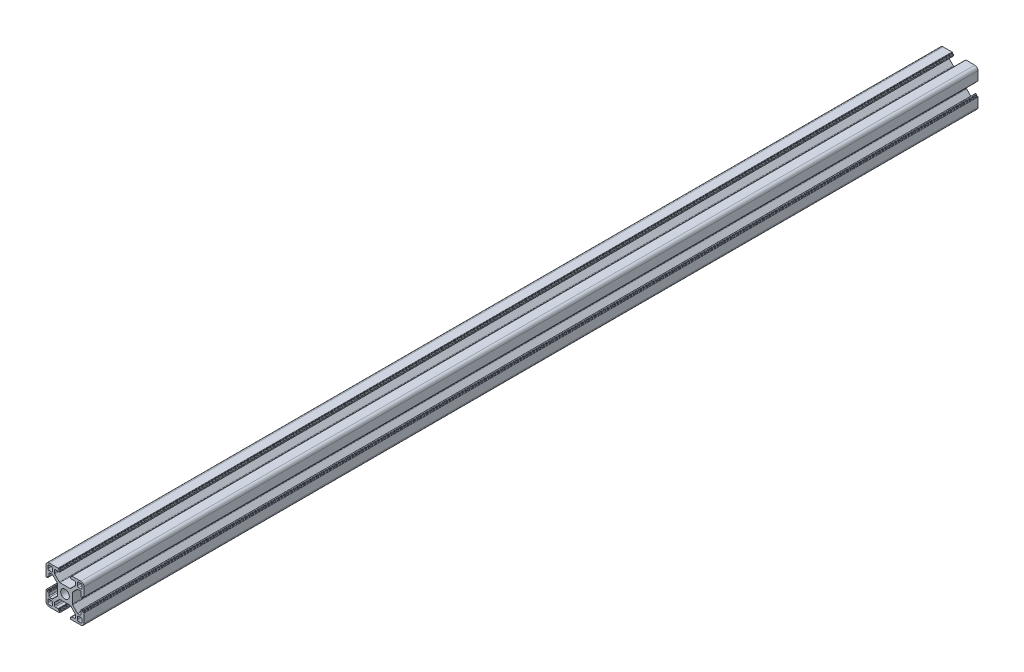
from build123d import *

# Parameters (mm, degrees)
SKETCH1_R           = 3.4
BOSS_EXTRUDE1_DEPTH = 706


with BuildPart() as part:
    # Sketch1 → Boss-Extrude1 (new body)
    with BuildSketch(Plane.XY):
        with BuildLine():
            Line((0, 2.5), (0, 10.6))
            ThreePointArc((0, 10.6), (0.058578644, 10.741421356), (0.2, 10.8))
            Line((0.2, 10.8), (1, 10.8))
            ThreePointArc((1, 10.8), (1.141421356, 10.741421356), (1.2, 10.6))
            Line((1.2, 10.6), (1.2, 9.9))
            ThreePointArc((1.2, 9.9), (1.258578644, 9.758578644), (1.4, 9.7))
            Line((1.4, 9.7), (2, 9.7))
            ThreePointArc((2, 9.7), (2.141421356, 9.641421356), (2.2, 9.5))
            Line((2.2, 9.5), (2.2, 7.4))
            ThreePointArc((2.2, 7.4), (2.419669914, 6.869669914), (2.95, 6.65))
            Line((2.95, 6.65), (4.78370491, 6.65))
            ThreePointArc((4.78370491, 6.65), (5.070717484, 6.707090351), (5.314034995, 6.869669914))
            Line((5.314034995, 6.869669914), (8.980330086, 10.535965005))
            ThreePointArc((8.980330086, 10.535965005), (9.142909649, 10.779282516), (9.2, 11.06629509))
            Line((9.2, 11.06629509), (9.2, 18.93370491))
            ThreePointArc((9.2, 18.93370491), (9.142909649, 19.220717484), (8.980330086, 19.464034995))
            Line((8.980330086, 19.464034995), (5.314034995, 23.130330086))
            ThreePointArc((5.314034995, 23.130330086), (5.070717484, 23.292909649), (4.78370491, 23.35))
            Line((4.78370491, 23.35), (2.95, 23.35))
            ThreePointArc((2.95, 23.35), (2.419669914, 23.130330086), (2.2, 22.6))
            Line((2.2, 22.6), (2.2, 20.5))
            ThreePointArc((2.2, 20.5), (2.141421356, 20.358578644), (2, 20.3))
            Line((2, 20.3), (1.4, 20.3))
            ThreePointArc((1.4, 20.3), (1.258578644, 20.241421356), (1.2, 20.1))
            Line((1.2, 20.1), (1.2, 19.4))
            ThreePointArc((1.2, 19.4), (1.141421356, 19.258578644), (1, 19.2))
            Line((1, 19.2), (0.2, 19.2))
            ThreePointArc((0.2, 19.2), (0.058578644, 19.258578644), (0, 19.4))
            Line((0, 19.4), (0, 27.5))
            ThreePointArc((0, 27.5), (0.732233047, 29.267766953), (2.5, 30))
            Line((2.5, 30), (9.5, 30))
            ThreePointArc((9.5, 30), (9.641421356, 29.941421356), (9.7, 29.8))
            Line((9.7, 29.8), (9.7, 29.2))
            ThreePointArc((9.7, 29.2), (9.758578644, 29.058578644), (9.9, 29))
            Line((9.9, 29), (10.6, 29))
            ThreePointArc((10.6, 29), (10.741421356, 28.941421356), (10.8, 28.8))
            Line((10.8, 28.8), (10.8, 28))
            ThreePointArc((10.8, 28), (10.741421356, 27.858578644), (10.6, 27.8))
            Line((10.6, 27.8), (7.4, 27.8))
            ThreePointArc((7.4, 27.8), (6.869669914, 27.580330086), (6.65, 27.05))
            Line((6.65, 27.05), (6.65, 25.21629509))
            ThreePointArc((6.65, 25.21629509), (6.707090351, 24.929282516), (6.869669914, 24.685965005))
            Line((6.869669914, 24.685965005), (10.535965005, 21.019669914))
            ThreePointArc((10.535965005, 21.019669914), (10.779282516, 20.857090351), (11.06629509, 20.8))
            Line((11.06629509, 20.8), (18.93370491, 20.8))
            ThreePointArc((18.93370491, 20.8), (19.220717484, 20.857090351), (19.464034995, 21.019669914))
            Line((19.464034995, 21.019669914), (23.130330086, 24.685965005))
            ThreePointArc((23.130330086, 24.685965005), (23.292909649, 24.929282516), (23.35, 25.21629509))
            Line((23.35, 25.21629509), (23.35, 27.05))
            ThreePointArc((23.35, 27.05), (23.130330086, 27.580330086), (22.6, 27.8))
            Line((22.6, 27.8), (19.4, 27.8))
            ThreePointArc((19.4, 27.8), (19.258578644, 27.858578644), (19.2, 28))
            Line((19.2, 28), (19.2, 28.8))
            ThreePointArc((19.2, 28.8), (19.258578644, 28.941421356), (19.4, 29))
            Line((19.4, 29), (20.1, 29))
            ThreePointArc((20.1, 29), (20.241421356, 29.058578644), (20.3, 29.2))
            Line((20.3, 29.2), (20.3, 29.8))
            ThreePointArc((20.3, 29.8), (20.358578644, 29.941421356), (20.5, 30))
            Line((20.5, 30), (27.5, 30))
            ThreePointArc((27.5, 30), (29.267766953, 29.267766953), (30, 27.5))
            Line((30, 27.5), (30, 20.5))
            ThreePointArc((30, 20.5), (29.941421356, 20.358578644), (29.8, 20.3))
            Line((29.8, 20.3), (29.2, 20.3))
            ThreePointArc((29.2, 20.3), (29.058578644, 20.241421356), (29, 20.1))
            Line((29, 20.1), (29, 19.4))
            ThreePointArc((29, 19.4), (28.941421356, 19.258578644), (28.8, 19.2))
            Line((28.8, 19.2), (28, 19.2))
            ThreePointArc((28, 19.2), (27.858578644, 19.258578644), (27.8, 19.4))
            Line((27.8, 19.4), (27.8, 22.6))
            ThreePointArc((27.8, 22.6), (27.580330086, 23.130330086), (27.05, 23.35))
            Line((27.05, 23.35), (25.21629509, 23.35))
            ThreePointArc((25.21629509, 23.35), (24.929282516, 23.292909649), (24.685965005, 23.130330086))
            Line((24.685965005, 23.130330086), (21.019669914, 19.464034995))
            ThreePointArc((21.019669914, 19.464034995), (20.857090351, 19.220717484), (20.8, 18.93370491))
            Line((20.8, 18.93370491), (20.8, 11.06629509))
            ThreePointArc((20.8, 11.06629509), (20.857090351, 10.779282516), (21.019669914, 10.535965005))
            Line((21.019669914, 10.535965005), (24.685965005, 6.869669914))
            ThreePointArc((24.685965005, 6.869669914), (24.929282516, 6.707090351), (25.21629509, 6.65))
            Line((25.21629509, 6.65), (27.05, 6.65))
            ThreePointArc((27.05, 6.65), (27.580330086, 6.869669914), (27.8, 7.4))
            Line((27.8, 7.4), (27.8, 10.6))
            ThreePointArc((27.8, 10.6), (27.858578644, 10.741421356), (28, 10.8))
            Line((28, 10.8), (28.8, 10.8))
            ThreePointArc((28.8, 10.8), (28.941421356, 10.741421356), (29, 10.6))
            Line((29, 10.6), (29, 9.9))
            ThreePointArc((29, 9.9), (29.058578644, 9.758578644), (29.2, 9.7))
            Line((29.2, 9.7), (29.8, 9.7))
            ThreePointArc((29.8, 9.7), (29.941421356, 9.641421356), (30, 9.5))
            Line((30, 9.5), (30, 2.5))
            ThreePointArc((30, 2.5), (29.267766953, 0.732233047), (27.5, 0))
            Line((27.5, 0), (19.4, 0))
            ThreePointArc((19.4, 0), (19.258578644, 0.058578644), (19.2, 0.2))
            Line((19.2, 0.2), (19.2, 1.132430858))
            ThreePointArc((19.2, 1.132430858), (19.258578644, 1.273852214), (19.4, 1.332430858))
            Line((19.4, 1.332430858), (20.1, 1.332430858))
            ThreePointArc((20.1, 1.332430858), (20.241421356, 1.391009502), (20.3, 1.532430858))
            Line((20.3, 1.532430858), (20.3, 2))
            ThreePointArc((20.3, 2), (20.358578644, 2.141421356), (20.5, 2.2))
            Line((20.5, 2.2), (22.6, 2.2))
            ThreePointArc((22.6, 2.2), (23.130330086, 2.419669914), (23.35, 2.95))
            Line((23.35, 2.95), (23.35, 4.916135768))
            ThreePointArc((23.35, 4.916135768), (23.292909649, 5.203148342), (23.130330086, 5.446465854))
            Line((23.130330086, 5.446465854), (19.464034995, 9.112760944))
            ThreePointArc((19.464034995, 9.112760944), (19.220717484, 9.275340508), (18.93370491, 9.332430858))
            Line((18.93370491, 9.332430858), (11.06629509, 9.332430858))
            ThreePointArc((11.06629509, 9.332430858), (10.779282516, 9.275340508), (10.535965005, 9.112760944))
            Line((10.535965005, 9.112760944), (6.869669914, 5.446465854))
            ThreePointArc((6.869669914, 5.446465854), (6.707090351, 5.203148342), (6.65, 4.916135768))
            Line((6.65, 4.916135768), (6.65, 3.082430858))
            ThreePointArc((6.65, 3.082430858), (6.869669914, 2.552100772), (7.4, 2.332430858))
            Line((7.4, 2.332430858), (9.5, 2.332430858))
            ThreePointArc((9.5, 2.332430858), (9.641421356, 2.273852214), (9.7, 2.132430858))
            Line((9.7, 2.132430858), (9.7, 1.532430858))
            ThreePointArc((9.7, 1.532430858), (9.758578644, 1.391009502), (9.9, 1.332430858))
            Line((9.9, 1.332430858), (10.6, 1.332430858))
            ThreePointArc((10.6, 1.332430858), (10.741421356, 1.273852214), (10.8, 1.132430858))
            Line((10.8, 1.132430858), (10.8, 0.2))
            ThreePointArc((10.8, 0.2), (10.741421356, 0.058578644), (10.6, 0))
            Line((10.6, 0), (2.5, 0))
            ThreePointArc((2.5, 0), (0.732233047, 0.732233047), (0, 2.5))
        make_face()
        with Locations((15, 15)):
            Circle(SKETCH1_R, mode=Mode.SUBTRACT)
        with BuildLine():
            Line((27.55, 1.45), (25.8, 1.45))
            ThreePointArc((25.8, 1.45), (25.092893219, 1.742893219), (24.8, 2.45))
            Line((24.8, 2.45), (24.8, 4.2))
            ThreePointArc((24.8, 4.2), (25.092893219, 4.907106781), (25.8, 5.2))
            Line((25.8, 5.2), (27.55, 5.2))
            ThreePointArc((27.55, 5.2), (28.257106781, 4.907106781), (28.55, 4.2))
            Line((28.55, 4.2), (28.55, 2.45))
            ThreePointArc((28.55, 2.45), (28.257106781, 1.742893219), (27.55, 1.45))
        make_face(mode=Mode.SUBTRACT)
        with BuildLine():
            Line((24.8, 25.8), (24.8, 27.55))
            ThreePointArc((24.8, 27.55), (25.092893219, 28.257106781), (25.8, 28.55))
            Line((25.8, 28.55), (27.55, 28.55))
            ThreePointArc((27.55, 28.55), (28.257106781, 28.257106781), (28.55, 27.55))
            Line((28.55, 27.55), (28.55, 25.8))
            ThreePointArc((28.55, 25.8), (28.257106781, 25.092893219), (27.55, 24.8))
            Line((27.55, 24.8), (25.8, 24.8))
            ThreePointArc((25.8, 24.8), (25.092893219, 25.092893219), (24.8, 25.8))
        make_face(mode=Mode.SUBTRACT)
        with BuildLine():
            Line((2.45, 28.55), (4.2, 28.55))
            ThreePointArc((4.2, 28.55), (4.907106781, 28.257106781), (5.2, 27.55))
            Line((5.2, 27.55), (5.2, 25.8))
            ThreePointArc((5.2, 25.8), (4.907106781, 25.092893219), (4.2, 24.8))
            Line((4.2, 24.8), (2.45, 24.8))
            ThreePointArc((2.45, 24.8), (1.742893219, 25.092893219), (1.45, 25.8))
            Line((1.45, 25.8), (1.45, 27.55))
            ThreePointArc((1.45, 27.55), (1.742893219, 28.257106781), (2.45, 28.55))
        make_face(mode=Mode.SUBTRACT)
        with BuildLine():
            Line((1.45, 2.45), (1.45, 4.2))
            ThreePointArc((1.45, 4.2), (1.742893219, 4.907106781), (2.45, 5.2))
            Line((2.45, 5.2), (4.2, 5.2))
            ThreePointArc((4.2, 5.2), (4.907106781, 4.907106781), (5.2, 4.2))
            Line((5.2, 4.2), (5.2, 2.45))
            ThreePointArc((5.2, 2.45), (4.907106781, 1.742893219), (4.2, 1.45))
            Line((4.2, 1.45), (2.45, 1.45))
            ThreePointArc((2.45, 1.45), (1.742893219, 1.742893219), (1.45, 2.45))
        make_face(mode=Mode.SUBTRACT)
    extrude(amount=BOSS_EXTRUDE1_DEPTH)


solid = part.part
